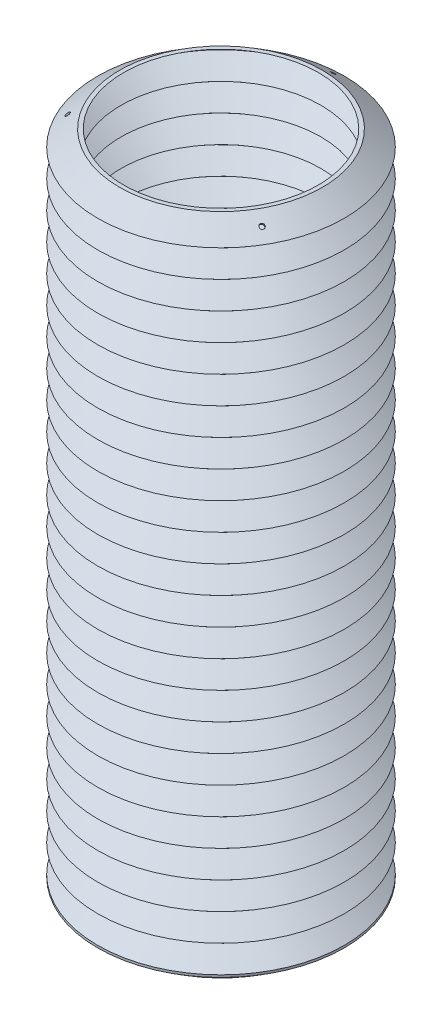
from build123d import *

# Parameters (mm, degrees)
SKETCH1_R               = 1.016
SKETCH1_R_2             = 1.5875
SKETCH1_W               = 30.226
SKETCH1_H               = 1.016
BOSS_EXTRUDE1_DEPTH     = 1.778
CUT_EXTRUDE1_DEPTH      = 220.775953397
CUT_EXTRUDE1_DEPTH_BACK = 220.775953397
SKETCH10_R              = 0.762
CUT_EXTRUDE2_DEPTH      = 2.54
CIRPATTERN1_COUNT       = 3
MIRROR7_COPY_1_SKETCH_R = 0.762
MIRROR7_COPY_1_DEPTH    = 2.54
MIRROR7_COPY_2_SKETCH_R = 0.762
MIRROR7_COPY_2_DEPTH    = 2.54
MIRROR7_COPY_3_SKETCH_R = 0.762
MIRROR7_COPY_3_DEPTH    = 2.54


with BuildPart() as part:
    # Sketch1 → Boss-Extrude1 (new body)
    with BuildSketch(Plane(origin=(0, 0, 0), x_dir=(1, 0, 0), z_dir=(0, 1, 0))):
        with BuildLine():
            Line((19.797340731, -27.686), (33.875449694, -3.302))
            ThreePointArc((33.875449694, -3.302), (33.875449694, 19.558), (14.078108964, 30.988))
            Line((14.078108964, 30.988), (-14.078108964, 30.988))
            ThreePointArc((-14.078108964, 30.988), (-33.875449694, 19.558), (-33.875449694, -3.302))
            Line((-33.875449694, -3.302), (-19.797340731, -27.686))
            ThreePointArc((-19.797340731, -27.686), (0, -39.116), (19.797340731, -27.686))
        make_face()
        with Locations((0, 10.668)):
            Circle(SKETCH1_R, mode=Mode.SUBTRACT)
        with Locations((9.238759008, -5.334)):
            Circle(SKETCH1_R, mode=Mode.SUBTRACT)
        with Locations((-9.238759008, -5.334)):
            Circle(SKETCH1_R, mode=Mode.SUBTRACT)
        Circle(SKETCH1_R_2, mode=Mode.SUBTRACT)
        with Locations((0, 27.94)):
            Rectangle(SKETCH1_W, SKETCH1_H, mode=Mode.SUBTRACT)
        Polygon((32.193190687, -1.135758073), (31.313308877, -0.627758073), (16.200308877, -26.804241927), (17.080190687, -27.312241927), align=None, mode=Mode.SUBTRACT)
        Polygon((-17.080190687, -27.312241927), (-16.200308877, -26.804241927), (-31.313308877, -0.627758073), (-32.193190687, -1.135758073), align=None, mode=Mode.SUBTRACT)
    extrude(amount=BOSS_EXTRUDE1_DEPTH)

    # Sweep1: sweep along a path in Sketch3
    with BuildLine(Plane(origin=(0, 1.778, 0), x_dir=(1, 0, 0), z_dir=(0, 1, 0))) as sweep1_path:
        CenterArc((0, -11.938), 39.878, 0, 360)
    # Sketch4 → Sweep1 (sweep)
    with BuildSketch(Plane(origin=(0, 0, 0), x_dir=(0, 0, -1), z_dir=(1, 0, 0))):
        Polygon((28.598946584, 0), (28.598946584, 2.534258856), (22.248946584, 7.034258856), (28.598946584, 11.534258856), (22.248946584, 16.034258856), (28.598946584, 20.534258856), (22.248946584, 25.034258856), (28.598946584, 29.534258856), (22.248946584, 34.034258856), (28.598946584, 38.534258856), (22.248946584, 43.034258856), (28.598946584, 47.534258856), (22.248946584, 52.034258856), (28.598946584, 56.534258856), (22.248946584, 61.034258856), (28.598946584, 65.534258856), (22.248946584, 70.034258856), (28.598946584, 74.534258856), (22.248946584, 79.034258856), (28.598946584, 83.534258856), (22.248946584, 88.034258856), (28.598946584, 92.534258856), (22.248946584, 97.034258856), (28.598946584, 101.534258856), (22.248946584, 106.034258856), (28.598946584, 110.534258856), (22.248946584, 115.034258856), (28.598946584, 119.534258856), (22.248946584, 124.034258856), (28.598946584, 128.534258856), (22.248946584, 133.034258856), (28.598946584, 137.534258856), (22.248946584, 142.034258856), (28.598946584, 146.534258856), (22.248946584, 151.034258856), (28.598946584, 155.534258856), (22.248946584, 160.034258856), (28.598946584, 164.534258856), (22.248946584, 169.034258856), (28.598946584, 173.534258856), (22.248946584, 178.034258856), (28.598946584, 182.534258856), (22.248946584, 187.034258856), (28.598946584, 191.534258856), (22.248946584, 196.034258856), (28.598946584, 200.534258856), (22.248946584, 205.034258856), (28.598946584, 209.534258856), (27.281053416, 209.534258856), (20.931053416, 205.034258856), (27.281053416, 200.534258856), (20.931053416, 196.034258856), (27.281053416, 191.534258856), (20.931053416, 187.034258856), (27.281053416, 182.534258856), (20.931053416, 178.034258856), (27.281053416, 173.534258856), (20.931053416, 169.034258856), (27.281053416, 164.534258856), (20.931053416, 160.034258856), (27.281053416, 155.534258856), (20.931053416, 151.034258856), (27.281053416, 146.534258856), (20.931053416, 142.034258856), (27.281053416, 137.534258856), (20.931053416, 133.034258856), (27.281053416, 128.534258856), (20.931053416, 124.034258856), (27.281053416, 119.534258856), (20.931053416, 115.034258856), (27.281053416, 110.534258856), (20.931053416, 106.034258856), (27.281053416, 101.534258856), (20.931053416, 97.034258856), (27.281053416, 92.534258856), (20.931053416, 88.034258856), (27.281053416, 83.534258856), (20.931053416, 79.034258856), (27.281053416, 74.534258856), (20.931053416, 70.034258856), (27.281053416, 65.534258856), (20.931053416, 61.034258856), (27.281053416, 56.534258856), (20.931053416, 52.034258856), (27.281053416, 47.534258856), (20.931053416, 43.034258856), (27.281053416, 38.534258856), (20.931053416, 34.034258856), (27.281053416, 29.534258856), (20.931053416, 25.034258856), (27.281053416, 20.534258856), (20.931053416, 16.034258856), (27.281053416, 11.534258856), (20.931053416, 7.034258856), (27.281053416, 2.534258856), (27.281053416, 0), align=None)
    sweep(path=sweep1_path.line)

    # Sketch5 → Cut-Extrude1 (cut, two sides: drawn at the far end of the back side and taken through both)
    with BuildSketch(Plane(origin=(0, 0, 0), x_dir=(0, 0, -1), z_dir=(1, 0, 0)).offset(-CUT_EXTRUDE1_DEPTH_BACK)):
        Polygon((-3.302, 1.778), (53.644453892, 1.778), (53.644453892, 0), (-109.531045718, -2.438778333), (-109.531045718, 1.778), (-27.686, 1.778), align=None)
    extrude(amount=CUT_EXTRUDE1_DEPTH + CUT_EXTRUDE1_DEPTH_BACK, mode=Mode.SUBTRACT)

    # Sweep2: sweep along a curve in space
    with BuildLine() as sweep2_path:
        ThreePointArc((0, 1.778, -28.598946584), (28.663949818, 1.778, -16.725949818), (40.536946584, 1.778, 11.938))
        ThreePointArc((40.536946584, 1.778, 11.938), (28.663949818, 1.778, 40.601949818), (0, 1.778, 52.474946584))
        ThreePointArc((0, 1.778, 52.474946584), (-28.663949818, 1.778, 40.601949818), (-40.536946584, 1.778, 11.938))
        ThreePointArc((-40.536946584, 1.778, 11.938), (-28.663949818, 1.778, -16.725949818), (0, 1.778, -28.598946584))
    # Sketch8 → Sweep2 (sweep)
    with BuildSketch(Plane(origin=(0, 0, 0), x_dir=(0, 0, -1), z_dir=(1, 0, 0))):
        Polygon((27.281053416, 1.778), (20.093617346, -3.453908136), (21.411510514, -3.453908136), (28.598946584, 1.778), align=None)
    sweep(path=sweep2_path.line)

    # Sketch12 → Revolve1 (revolve)
    with BuildSketch(Plane(origin=(0, 0, 0), x_dir=(0, 0, -1), z_dir=(1, 0, 0))):
        Polygon((28.598946584, 1.778), (27.281053416, 1.778), (20.093617346, -3.453908136), (21.411510514, -3.453908136), align=None)
        Polygon((20.093617346, 214.766166991), (21.411510514, 214.766166991), (28.598946584, 209.534258856), (27.281053416, 208.600318815), (27.281053416, 209.534258856), align=None)
    revolve(axis=Axis((0, 209.534258856, 11.938), (0, 1, 0)))

    # Sketch10 → Cut-Extrude2 (cut, symmetric)
    with BuildSketch(Plane(origin=(0, -12.445383757, -9.059295122), x_dir=(1, 0, 0), z_dir=(0, 0.8084854971869895, 0.5885161007468755))):
        with Locations((0, 19.668215175)):
            Circle(SKETCH10_R)
    cut_extrude2 = extrude(amount=CUT_EXTRUDE2_DEPTH, both=True, mode=Mode.SUBTRACT)

    # CirPattern1: Cut-Extrude2 ×3 about axis
    cirpattern1_axis = Axis((0, 1.778, 11.938), (0, -1, 0))
    for i in range(1, CIRPATTERN1_COUNT):
        add(cut_extrude2.rotate(cirpattern1_axis, i * 360 / CIRPATTERN1_COUNT), mode=Mode.SUBTRACT)

    # Mirror7 copy 1 sketch → Mirror7 copy 1 (cut, symmetric)
    with BuildSketch(Plane(origin=(18.184190987, 223.757642613, 22.436647561), x_dir=(-0.4999999999999998, 0, 0.8660254037844387), z_dir=(-0.5096698937829564, -0.8084854971869895, -0.29425805037343766))):
        with Locations((0, -19.668215175)):
            Circle(MIRROR7_COPY_1_SKETCH_R)
    extrude(amount=MIRROR7_COPY_1_DEPTH, both=True, mode=Mode.SUBTRACT)

    # Mirror7 copy 2 sketch → Mirror7 copy 2 (cut, symmetric)
    with BuildSketch(Plane(origin=(-18.184190987, 223.757642613, 22.436647561), x_dir=(-0.5000000000000004, 0, -0.8660254037844384), z_dir=(0.5096698937829561, -0.8084854971869895, -0.29425805037343805))):
        with Locations((0, -19.668215175)):
            Circle(MIRROR7_COPY_2_SKETCH_R)
    extrude(amount=MIRROR7_COPY_2_DEPTH, both=True, mode=Mode.SUBTRACT)

    # Mirror7 copy 3 sketch → Mirror7 copy 3 (cut, symmetric)
    with BuildSketch(Plane(origin=(0, 223.757642613, -9.059295122), x_dir=(1, 0, 0), z_dir=(0, -0.8084854971869895, 0.5885161007468755))):
        with Locations((0, -19.668215175)):
            Circle(MIRROR7_COPY_3_SKETCH_R)
    extrude(amount=MIRROR7_COPY_3_DEPTH, both=True, mode=Mode.SUBTRACT)


solid = part.part
